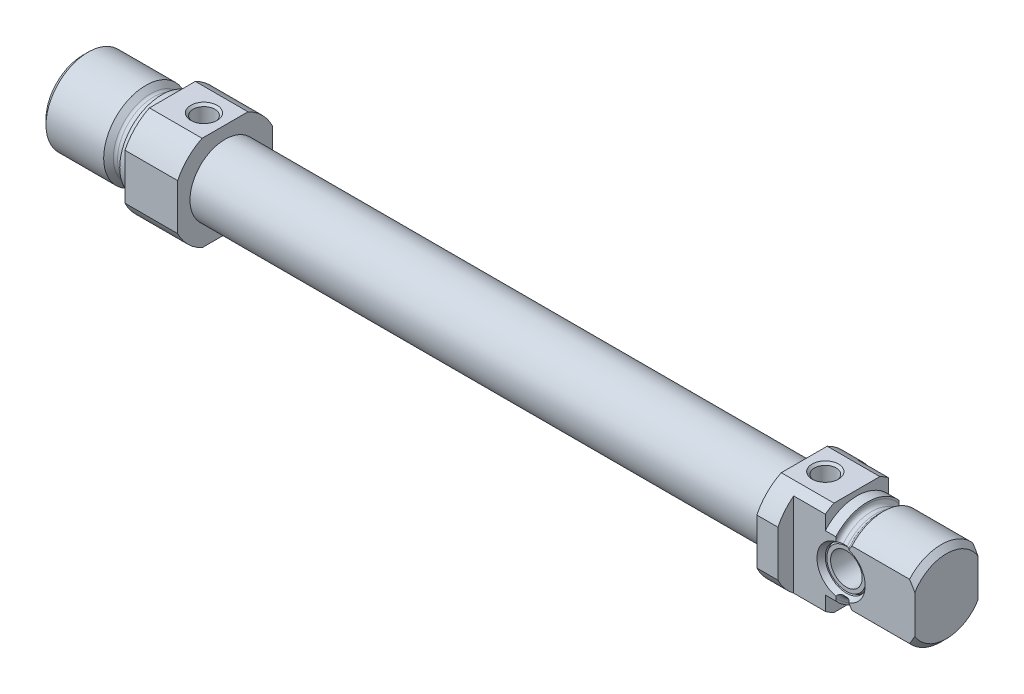
from build123d import *

# Parameters (mm, degrees)
BOSS_EXTRUDE1_DEPTH     = 10
SKETCH3_W               = 110
SKETCH3_H               = 6.65
SKETCH4_W               = 18
SKETCH4_H               = 18
BOSS_EXTRUDE2_DEPTH     = 10
SKETCH5_W               = 10
SKETCH5_H               = 10
CUT_EXTRUDE1_DEPTH      = 10
CUT_EXTRUDE1_DEPTH_BACK = 10
HOLE1_D                 = 4.134
HOLE1_DEPTH             = 9
HOLE1_CSINK_D           = 5
HOLE1_CSINK_ANGLE       = 90
HOLE2_D                 = 4.134
HOLE2_DEPTH             = 11
HOLE2_CSINK_D           = 5
HOLE2_CSINK_ANGLE       = 90
HOLE2_TIP               = 1.193383006


with BuildPart() as part:
    # Sketch1 → Revolve1 (revolve)
    with BuildSketch(Plane.XY):
        with BuildLine():
            Line((0, 0), (0, 7))
            Line((0, 7), (1, 8))
            Line((1, 8), (11.95, 8))
            Line((11.95, 8), (12.865685425, 7.084314575))
            ThreePointArc((12.865685425, 7.084314575), (13.125224104, 6.910896374), (13.43137085, 6.85))
            Line((13.43137085, 6.85), (14.2, 6.85))
            ThreePointArc((14.2, 6.85), (14.765685425, 7.084314575), (15, 7.65))
            Line((15, 7.65), (15, 8))
            Line((15, 8), (17, 8))
            Line((17, 8), (17, 0))
            Line((17, 0), (0, 0))
        make_face()
    revolve(axis=Axis((17, 0, 0), (-1, 0, 0)))

    # Sketch2 → Boss-Extrude1 (add)
    with BuildSketch(Plane(origin=(17, 0, 0), x_dir=(0, 0, -1), z_dir=(1, 0, 0))):
        with BuildLine():
            Line((-4.358898944, -9), (4.358898944, -9))
            ThreePointArc((4.358898944, -9), (7.071067812, -7.071067812), (9, -4.358898944))
            Line((9, -4.358898944), (9, 4.358898944))
            ThreePointArc((9, 4.358898944), (7.071067812, 7.071067812), (4.358898944, 9))
            Line((4.358898944, 9), (-4.358898944, 9))
            ThreePointArc((-4.358898944, 9), (-7.071067812, 7.071067812), (-9, 4.358898944))
            Line((-9, 4.358898944), (-9, -4.358898944))
            ThreePointArc((-9, -4.358898944), (-7.071067812, -7.071067812), (-4.358898944, -9))
        make_face()
    extrude(amount=BOSS_EXTRUDE1_DEPTH)

    # Sketch3 → Revolve2 (revolve)
    with BuildSketch(Plane.XY):
        with Locations((82, 3.325)):
            Rectangle(SKETCH3_W, SKETCH3_H)
    revolve(axis=Axis((137, 0, 0), (-1, 0, 0)))

    # Sketch4 → Boss-Extrude2 (add)
    with BuildSketch(Plane(origin=(137, 0, 0), x_dir=(0, 0, -1), z_dir=(1, 0, 0))):
        Rectangle(SKETCH4_W, SKETCH4_H)
    extrude(amount=BOSS_EXTRUDE2_DEPTH)

    # Sketch5 → Cut-Revolve1 (revolve, cut)
    with BuildSketch(Plane.XY):
        with Locations((142, 15)):
            Rectangle(SKETCH5_W, SKETCH5_H)
    revolve(axis=Axis((147, 0, 0), (-1, 0, 0)), mode=Mode.SUBTRACT)

    # Sketch6 → Revolve3 (revolve)
    with BuildSketch(Plane.XY):
        with BuildLine():
            Line((147, 0), (147, 8))
            Line((147, 8), (149, 8))
            Line((149, 8), (149, 7.65))
            ThreePointArc((149, 7.65), (149.234314575, 7.084314575), (149.8, 6.85))
            Line((149.8, 6.85), (150.56862915, 6.85))
            ThreePointArc((150.56862915, 6.85), (150.874775896, 6.910896374), (151.134314575, 7.084314575))
            Line((151.134314575, 7.084314575), (152.05, 8))
            Line((152.05, 8), (163, 8))
            Line((163, 8), (164, 7))
            Line((164, 7), (164, 0))
            Line((164, 0), (147, 0))
        make_face()
    revolve(axis=Axis((164, 0, 0), (-1, 0, 0)))

    # Sketch7 → Cut-Extrude1 (cut, two sides: drawn at the far end of the back side and taken through both)
    with BuildSketch(Plane(origin=(0, 0, 0), x_dir=(1, 0, 0), z_dir=(0, 1, 0)).offset(-CUT_EXTRUDE1_DEPTH_BACK)):
        Polygon((141, 18), (141, 6), (164, 6), (164, -6), (141, -6), (141, -18), (176, -18), (176, 18), align=None)
    extrude(amount=CUT_EXTRUDE1_DEPTH + CUT_EXTRUDE1_DEPTH_BACK, mode=Mode.SUBTRACT)

    # Sketch8 → Cut-Revolve2 (revolve, cut)
    with BuildSketch(Plane(origin=(150, 0, 0), x_dir=(0, 0, -1), z_dir=(1, 0, 0))):
        Polygon((-6.2, 0), (-6.2, 4.692820323), (-5, 4), (-4.5, 4), (-5, 3.711324865), (-5, 3), (5, 3), (5, 3.711324865), (4.5, 4), (5, 4), (6.2, 4.692820323), (6.2, 0), align=None)
    revolve(axis=Axis((150, 0, -5), (0, 0, 1)), mode=Mode.SUBTRACT)

    # Hole1
    with Locations(Plane(origin=(0, 9, 0), x_dir=(1, 0, 0), z_dir=(0, 1, 0))):
        with Locations((23, 0)):
            CounterSinkHole(HOLE1_D / 2, HOLE1_CSINK_D / 2, depth=HOLE1_DEPTH, counter_sink_angle=HOLE1_CSINK_ANGLE)

    # Hole2
    with Locations(Plane(origin=(0, 9, 0), x_dir=(1, 0, 0), z_dir=(0, 1, 0))):
        with Locations((141, 0)):
            CounterSinkHole(HOLE2_D / 2, HOLE2_CSINK_D / 2, depth=HOLE2_DEPTH, counter_sink_angle=HOLE2_CSINK_ANGLE)
            with Locations((0, 0, -(HOLE2_DEPTH + HOLE2_TIP / 2))):  # 120° drill point
                Cone(0, HOLE2_D / 2, HOLE2_TIP, mode=Mode.SUBTRACT)

    # Sketch13 → Cut-Revolve3 (revolve, cut)
    with BuildSketch(Plane.XY):
        Polygon((-5, 0), (-5, 3), (37.3, 3), (37.3, 6), (120.3, 6), (120.3, 0), align=None)
    revolve(axis=Axis((120.3, 0, 0), (-1, 0, 0)), mode=Mode.SUBTRACT)


solid = part.part
